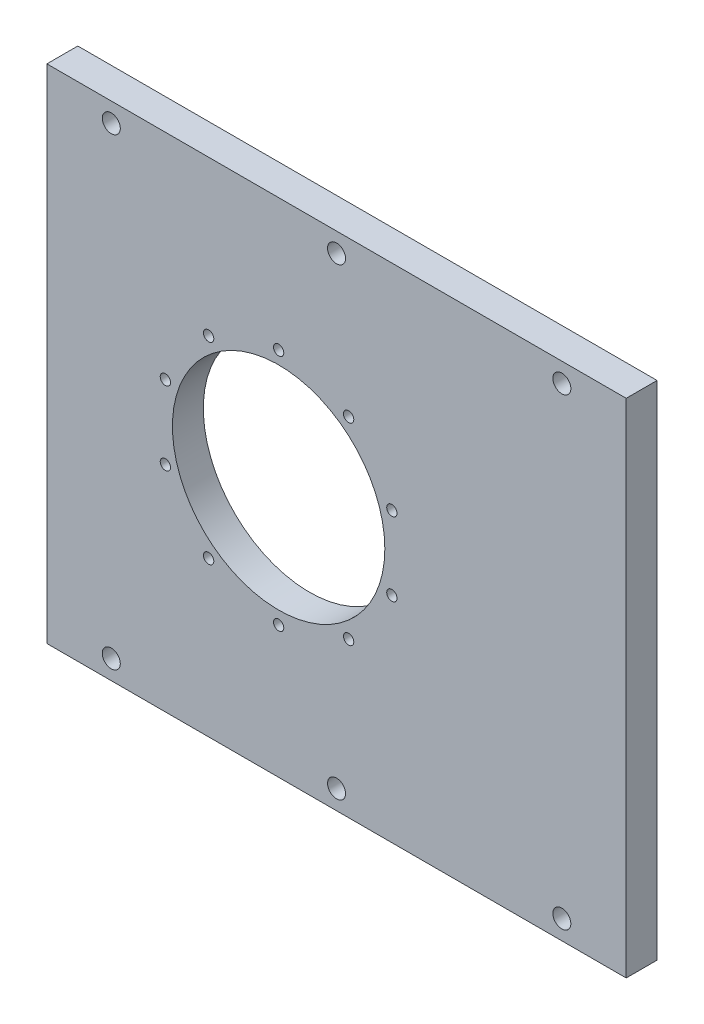
from build123d import *

# Parameters (mm, degrees)
SKETCH_1_W          = 450
SKETCH_1_H          = 390
SKETCH_1_R          = 82.5
EXTRUDE_1_DEPTH     = 24
CUT_EXTRUDE_START   = 24
SKETCH_1_3_R        = 4
SKETCH_1_3_R_2      = 7
CUT_EXTRUDE_1_DEPTH = 18


with BuildPart() as part:
    # 草图1 → 凸台-拉伸1 (new body)
    with BuildSketch(Plane.XY):
        Rectangle(SKETCH_1_W, SKETCH_1_H)
        with Locations((-45, 0)):
            Circle(SKETCH_1_R, mode=Mode.SUBTRACT)
    extrude(amount=EXTRUDE_1_DEPTH)

    # 草图1<3> → 切除-拉伸1 (cut)
    with BuildSketch(Plane.XY.offset(CUT_EXTRUDE_START)):
        with Locations(Location((-45, 92.5, 0), (0, 0, 180))):
            Circle(SKETCH_1_3_R)
        with Locations(Location((9.370135837, 74.83407198, 0), (0, 0, 180))):
            Circle(SKETCH_1_3_R)
        with Locations(Location((42.972727757, 28.58407198, 0), (0, 0, 180))):
            Circle(SKETCH_1_3_R)
        with Locations(Location((42.972727757, -28.58407198, 0), (0, 0, 180))):
            Circle(SKETCH_1_3_R)
        with Locations(Location((9.370135837, -74.83407198, 0), (0, 0, 180))):
            Circle(SKETCH_1_3_R)
        with Locations(Location((-45, -92.5, 0), (0, 0, 180))):
            Circle(SKETCH_1_3_R)
        with Locations(Location((-99.370135837, -74.83407198, 0), (0, 0, 180))):
            Circle(SKETCH_1_3_R)
        with Locations(Location((-132.972727757, -28.58407198, 0), (0, 0, 180))):
            Circle(SKETCH_1_3_R)
        with Locations(Location((-132.972727757, 28.58407198, 0), (0, 0, 180))):
            Circle(SKETCH_1_3_R)
        with Locations(Location((-99.370135837, 74.83407198, 0), (0, 0, 180))):
            Circle(SKETCH_1_3_R)
        with Locations(Location((0, 180, 0), (0, 0, 180))):
            Circle(SKETCH_1_3_R_2)
        with Locations(Location((-175, 180, 0), (0, 0, 180))):
            Circle(SKETCH_1_3_R_2)
        with Locations(Location((175, 180, 0), (0, 0, 180))):
            Circle(SKETCH_1_3_R_2)
        with Locations(Location((-175, -180, 0), (0, 0, 180))):
            Circle(SKETCH_1_3_R_2)
        with Locations(Location((0, -180, 0), (0, 0, 180))):
            Circle(SKETCH_1_3_R_2)
        with Locations(Location((175, -180, 0), (0, 0, 180))):
            Circle(SKETCH_1_3_R_2)
    extrude(amount=-CUT_EXTRUDE_1_DEPTH, mode=Mode.SUBTRACT)


solid = part.part
